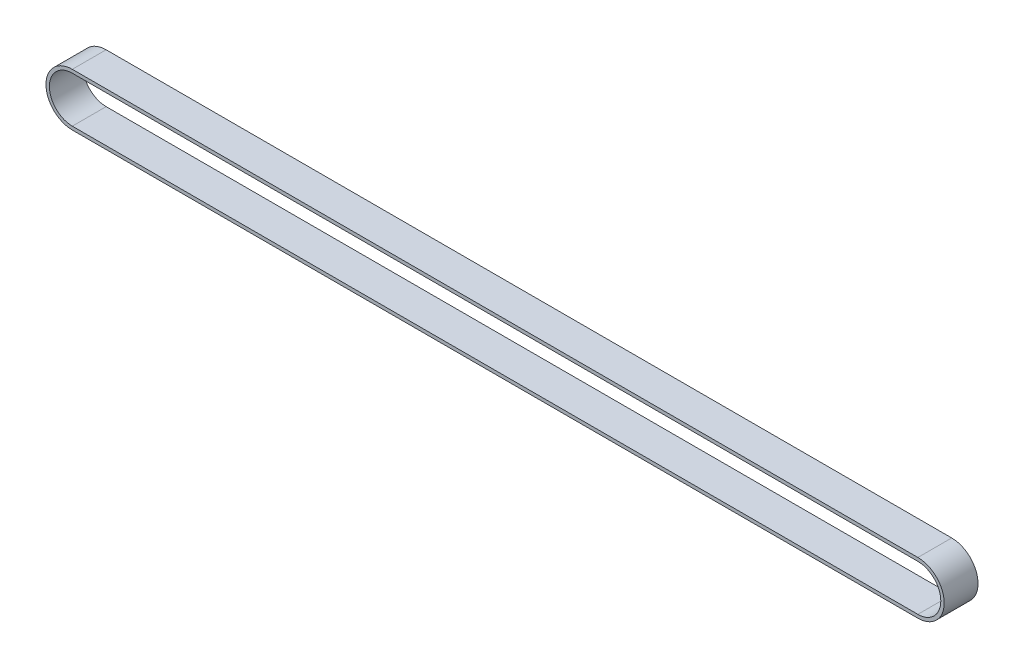
from build123d import *

# Parameters (mm, degrees)
EXTRUDE_1_DEPTH = 5


with BuildPart() as part:
    # 草图1 → 凸台-拉伸1 (new, symmetric)
    with BuildSketch(Plane.XY):
        with BuildLine():
            Line((125, -7.78), (-125, -7.78))
            ThreePointArc((-125, -7.78), (-132.78, 0), (-125, 7.78))
            Line((-125, 7.78), (125, 7.78))
            ThreePointArc((125, 7.78), (132.78, 0), (125, -7.78))
        make_face()
        with BuildLine():
            Line((125, -6.78), (-125, -6.78))
            ThreePointArc((-125, -6.78), (-131.78, 0), (-125, 6.78))
            Line((-125, 6.78), (125, 6.78))
            ThreePointArc((125, 6.78), (131.78, 0), (125, -6.78))
        make_face(mode=Mode.SUBTRACT)
    extrude(amount=EXTRUDE_1_DEPTH, both=True)


solid = part.part
